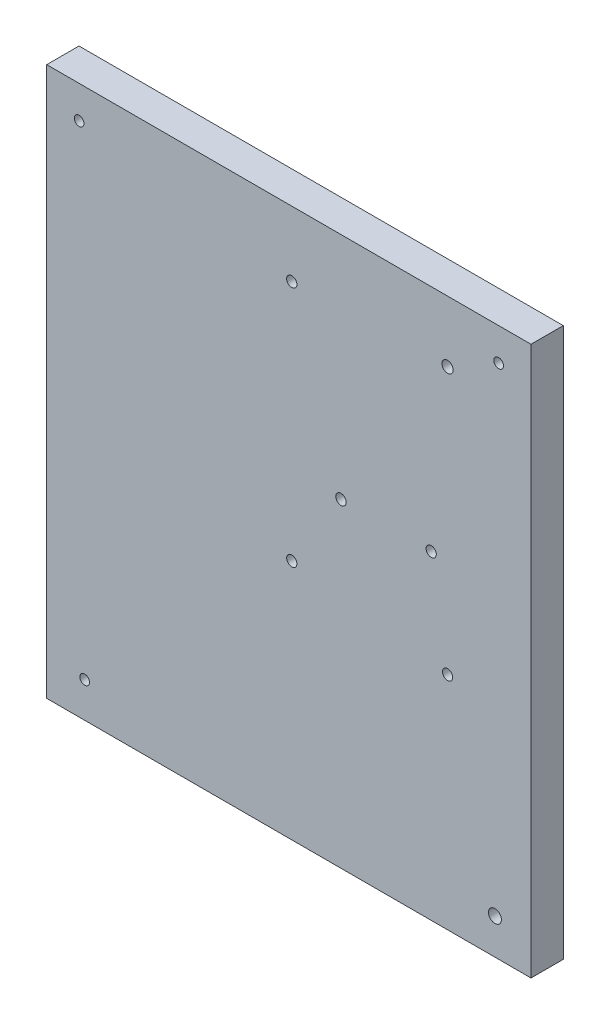
from build123d import *

# Parameters (mm, degrees)
ESBO_O1_W                = 150
ESBO_O1_H                = 170
RESSALTO_EXTRUS_O1_DEPTH = 10
ESBO_O2_R                = 1.5
ESBO_O2_R_2              = 1.997604937
ESBO_O2_R_3              = 1.5875
ESBO_O2_R_4              = 1.73833982
ESBO_O2_R_5              = 1.620055507
CORTE_EXTRUS_O1_DEPTH    = 46


with BuildPart() as part:
    # Esboço1 → Ressalto-extrusão1 (new body)
    with BuildSketch(Plane.XY):
        with Locations((75, 85)):
            Rectangle(ESBO_O1_W, ESBO_O1_H)
    extrude(amount=RESSALTO_EXTRUS_O1_DEPTH)

    # Esboço2 → Corte-extrusão1 (cut)
    with BuildSketch(Plane.XY):
        with Locations(Location((10.033029316, 159.94021292, 0), (0, 0, 180))):
            Circle(ESBO_O2_R)
        with Locations(Location((139.978914047, 159.94021292, 0), (0, 0, 180))):
            Circle(ESBO_O2_R)
        with Locations(Location((138.830146036, 11.036291662, 0), (0, 0, 180))):
            Circle(ESBO_O2_R_2)
        with Locations(Location((11.755699431, 10.926833837, 0), (0, 0, 180))):
            Circle(ESBO_O2_R)
        with Locations(Location((75.902413193, 149.76, 0), (0, 0, 180))):
            Circle(ESBO_O2_R_3)
        with Locations(Location((124.162413193, 151.03, 0), (0, 0, 180))):
            Circle(ESBO_O2_R_4)
        with Locations(Location((119.082413193, 98.96, 0), (0, 0, 180))):
            Circle(ESBO_O2_R_3)
        with Locations(Location((91.142413193, 98.96, 0), (0, 0, 180))):
            Circle(ESBO_O2_R_5)
        with Locations(Location((124.162413193, 68.48, 0), (0, 0, 180))):
            Circle(ESBO_O2_R_3)
        with Locations(Location((75.902413193, 74.83, 0), (0, 0, 180))):
            Circle(ESBO_O2_R_3)
    extrude(amount=CORTE_EXTRUS_O1_DEPTH, mode=Mode.SUBTRACT)


solid = part.part
